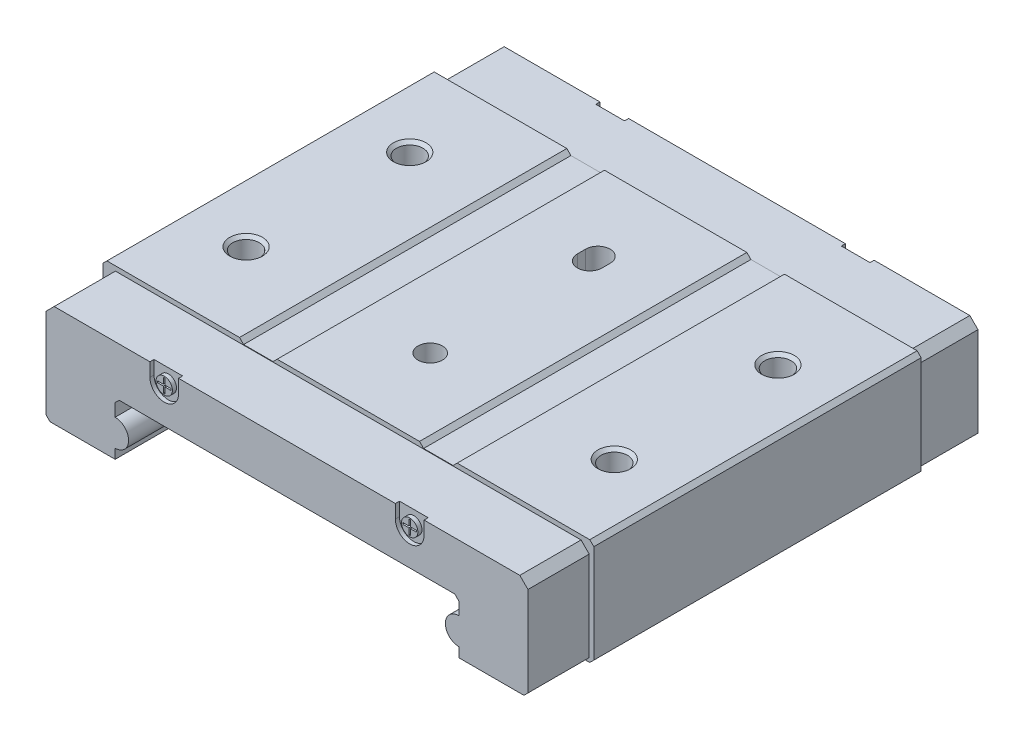
from build123d import *

# Parameters (mm, degrees)
BOSS_EXTRUDE1_DEPTH      = 20
BOSS_EXTRUDE1_DEPTH_BACK = 20
BOSS_EXTRUDE2_DEPTH      = 7.5
BOSS_EXTRUDE2_DEPTH_BACK = 7.5
SKETCH3_W                = 80
SKETCH3_H                = 80
CUT_EXTRUDE1_DEPTH       = 0.02
BOSS_EXTRUDE3_DEPTH      = 7.5
BOSS_EXTRUDE3_DEPTH_BACK = 7.5
CUT_EXTRUDE2_START       = -0.02
SKETCH5_W                = 80
SKETCH5_H                = 80
CUT_EXTRUDE2_DEPTH       = 0.02
CUT_EXTRUDE3_DEPTH       = 0.5
CUT_EXTRUDE3_DEPTH_BACK  = 0.5
CUT_EXTRUDE4_START       = -0.5
CUT_EXTRUDE4_DEPTH       = 0.5
SKETCH8_R                = 1
BOSS_EXTRUDE4_DEPTH      = 0.5
SKETCH9_R                = 1
BOSS_EXTRUDE5_DEPTH      = 0.5
BOSS_EXTRUDE6_START      = -0.5
SKETCH10_R               = 1
BOSS_EXTRUDE6_DEPTH      = 0.5
BOSS_EXTRUDE7_START      = -0.5
SKETCH11_R               = 1
BOSS_EXTRUDE7_DEPTH      = 0.5
SKETCH16_W               = 1.5
SKETCH16_H               = 4
CUT_EXTRUDE5_DEPTH       = 4


with BuildPart() as part:
    # Sketch1 → Boss-Extrude1 (new, two sides: drawn at the far end of the back side and taken through both)
    with BuildSketch(Plane.XY.offset(-BOSS_EXTRUDE1_DEPTH_BACK)):
        with BuildLine():
            Line((-30, 12.505025253), (-30, 0.494974747))
            Line((-30, 0.494974747), (-28.971123718, -0.533901535))
            Line((-28.971123718, -0.533901535), (-21, -0.533901535))
            Line((-21, -0.533901535), (-21, 1.176))
            ThreePointArc((-21, 1.176), (-19.36, 2.816), (-21, 4.456))
            Line((-21, 4.456), (-21, 6.005025253))
            Line((-21, 6.005025253), (-20.505025253, 6.5))
            Line((-20.505025253, 6.5), (20.505025253, 6.5))
            Line((20.505025253, 6.5), (21, 6.005025253))
            Line((21, 6.005025253), (21, 4.456))
            ThreePointArc((21, 4.456), (19.36, 2.816), (21, 1.176))
            Line((21, 1.176), (21, 0))
            Line((21, 0), (29.505025253, 0))
            Line((29.505025253, 0), (30, 0.494974747))
            Line((30, 0.494974747), (30, 12.505025253))
            Line((30, 12.505025253), (29.505025253, 13))
            Line((29.505025253, 13), (13.3, 13))
            Line((13.3, 13), (12.8, 12.5))
            Line((12.8, 12.5), (9.2, 12.5))
            Line((9.2, 12.5), (8.7, 13))
            Line((8.7, 13), (-8.7, 13))
            Line((-8.7, 13), (-9.2, 12.5))
            Line((-9.2, 12.5), (-12.8, 12.5))
            Line((-12.8, 12.5), (-13.3, 13))
            Line((-13.3, 13), (-29.505025253, 13))
            Line((-29.505025253, 13), (-30, 12.505025253))
        make_face()
    extrude(amount=BOSS_EXTRUDE1_DEPTH + BOSS_EXTRUDE1_DEPTH_BACK)

    # Sketch2 → Boss-Extrude2 (add, two sides: drawn at the far end of the back side and taken through both)
    with BuildSketch(Plane.XY.offset(20).offset(-BOSS_EXTRUDE2_DEPTH_BACK)):
        with BuildLine():
            Line((-29.45, 11.452979439), (-29.45, 0.494974747))
            Line((-29.45, 0.494974747), (-28.955025253, 0))
            Line((-28.955025253, 0), (-21, 0))
            Line((-21, 0), (-21, 1.176))
            ThreePointArc((-21, 1.176), (-19.36, 2.816), (-21, 4.456))
            Line((-21, 4.456), (-21, 6.005025253))
            Line((-21, 6.005025253), (-20.505025253, 6.5))
            Line((-20.505025253, 6.5), (20.505025253, 6.5))
            Line((20.505025253, 6.5), (21, 6.005025253))
            Line((21, 6.005025253), (21, 4.456))
            ThreePointArc((21, 4.456), (19.36, 2.816), (21, 1.176))
            Line((21, 1.176), (21, 0))
            Line((21, 0), (28.955025253, 0))
            Line((28.955025253, 0), (29.45, 0.494974747))
            Line((29.45, 0.494974747), (29.45, 11.452979439))
            Line((29.45, 11.452979439), (28.452979439, 12.45))
            Line((28.452979439, 12.45), (-28.452979439, 12.45))
            Line((-28.452979439, 12.45), (-29.45, 11.452979439))
        make_face()
    extrude(amount=BOSS_EXTRUDE2_DEPTH + BOSS_EXTRUDE2_DEPTH_BACK)

    # Sketch3 → Cut-Extrude1 (cut)
    with BuildSketch(Plane.XY.offset(20)):
        Rectangle(SKETCH3_W, SKETCH3_H)
        with BuildLine():
            Line((-29.44, 11.442979439), (-29.44, 0.504974747))
            Line((-29.44, 0.504974747), (-28.945025253, 0.01))
            Line((-28.945025253, 0.01), (-21.01, 0.01))
            Line((-21.01, 0.01), (-21.01, 1.206))
            ThreePointArc((-21.01, 1.206), (-19.39, 2.826), (-21.01, 4.446))
            Line((-21.01, 4.446), (-21.01, 6.51))
            Line((-21.01, 6.51), (21.01, 6.51))
            Line((21.01, 6.51), (21.01, 4.446))
            ThreePointArc((21.01, 4.446), (19.39, 2.826), (21.01, 1.206))
            Line((21.01, 1.206), (21.01, 0.01))
            Line((21.01, 0.01), (28.945025253, 0.01))
            Line((28.945025253, 0.01), (29.44, 0.504974747))
            Line((29.44, 0.504974747), (29.44, 11.442979439))
            Line((29.44, 11.442979439), (28.442979439, 12.44))
            Line((28.442979439, 12.44), (-28.442979439, 12.44))
            Line((-28.442979439, 12.44), (-29.44, 11.442979439))
        make_face(mode=Mode.SUBTRACT)
    extrude(amount=CUT_EXTRUDE1_DEPTH, mode=Mode.SUBTRACT)

    # Sketch4 → Boss-Extrude3 (add, two sides: drawn at the far end of the back side and taken through both)
    with BuildSketch(Plane.XY.offset(-20).offset(-BOSS_EXTRUDE3_DEPTH_BACK)):
        with BuildLine():
            Line((-29.45, 11.452979439), (-29.45, 0.494974747))
            Line((-29.45, 0.494974747), (-28.955025253, 0))
            Line((-28.955025253, 0), (-21, 0))
            Line((-21, 0), (-21, 1.176))
            ThreePointArc((-21, 1.176), (-19.36, 2.816), (-21, 4.456))
            Line((-21, 4.456), (-21, 6.005025253))
            Line((-21, 6.005025253), (-20.505025253, 6.5))
            Line((-20.505025253, 6.5), (20.505025253, 6.5))
            Line((20.505025253, 6.5), (21, 6.005025253))
            Line((21, 6.005025253), (21, 4.456))
            ThreePointArc((21, 4.456), (19.36, 2.816), (21, 1.176))
            Line((21, 1.176), (21, 0))
            Line((21, 0), (28.955025253, 0))
            Line((28.955025253, 0), (29.45, 0.494974747))
            Line((29.45, 0.494974747), (29.45, 11.452979439))
            Line((29.45, 11.452979439), (28.452979439, 12.45))
            Line((28.452979439, 12.45), (-28.452979439, 12.45))
            Line((-28.452979439, 12.45), (-29.45, 11.452979439))
        make_face()
    extrude(amount=BOSS_EXTRUDE3_DEPTH + BOSS_EXTRUDE3_DEPTH_BACK)

    # Sketch5 → Cut-Extrude2 (cut)
    with BuildSketch(Plane.XY.offset(-20).offset(CUT_EXTRUDE2_START)):
        Rectangle(SKETCH5_W, SKETCH5_H)
        with BuildLine():
            Line((-29.44, 11.442979439), (-29.44, 0.504974747))
            Line((-29.44, 0.504974747), (-28.945025253, 0.01))
            Line((-28.945025253, 0.01), (-21.01, 0.01))
            Line((-21.01, 0.01), (-21.01, 1.206))
            ThreePointArc((-21.01, 1.206), (-19.39, 2.826), (-21.01, 4.446))
            Line((-21.01, 4.446), (-21.01, 6.51))
            Line((-21.01, 6.51), (21.01, 6.51))
            Line((21.01, 6.51), (21.01, 4.446))
            ThreePointArc((21.01, 4.446), (19.39, 2.826), (21.01, 1.206))
            Line((21.01, 1.206), (21.01, 0.01))
            Line((21.01, 0.01), (28.945025253, 0.01))
            Line((28.945025253, 0.01), (29.44, 0.504974747))
            Line((29.44, 0.504974747), (29.44, 11.442979439))
            Line((29.44, 11.442979439), (28.442979439, 12.44))
            Line((28.442979439, 12.44), (-28.442979439, 12.44))
            Line((-28.442979439, 12.44), (-29.44, 11.442979439))
        make_face(mode=Mode.SUBTRACT)
    extrude(amount=CUT_EXTRUDE2_DEPTH, mode=Mode.SUBTRACT)

    # Sketch6 → Cut-Extrude3 (cut, two sides: drawn at the far end of the back side and taken through both)
    with BuildSketch(Plane.XY.offset(-27.5).offset(-CUT_EXTRUDE3_DEPTH_BACK)):
        with BuildLine():
            Line((-16.75, 32), (-16.75, 10.8))
            ThreePointArc((-16.75, 10.8), (-15, 9.05), (-13.25, 10.8))
            Line((-13.25, 10.8), (-13.25, 30.82500207))
            Line((-13.25, 30.82500207), (13.25, 30.82500207))
            Line((13.25, 30.82500207), (13.25, 10.8))
            ThreePointArc((13.25, 10.8), (15, 9.05), (16.75, 10.8))
            Line((16.75, 10.8), (16.75, 32))
            Line((16.75, 32), (-16.75, 32))
        make_face()
    extrude(amount=CUT_EXTRUDE3_DEPTH + CUT_EXTRUDE3_DEPTH_BACK, mode=Mode.SUBTRACT)

    # Sketch7 → Cut-Extrude4 (cut)
    with BuildSketch(Plane.XY.offset(27.5).offset(CUT_EXTRUDE4_START)):
        with BuildLine():
            Line((-16.75, 32), (-16.75, 10.8))
            ThreePointArc((-16.75, 10.8), (-15, 9.05), (-13.25, 10.8))
            Line((-13.25, 10.8), (-13.25, 30.82500207))
            Line((-13.25, 30.82500207), (13.25, 30.82500207))
            Line((13.25, 30.82500207), (13.25, 10.8))
            ThreePointArc((13.25, 10.8), (15, 9.05), (16.75, 10.8))
            Line((16.75, 10.8), (16.75, 32))
            Line((16.75, 32), (-16.75, 32))
        make_face()
    extrude(amount=CUT_EXTRUDE4_DEPTH, mode=Mode.SUBTRACT)

    # Sketch8 → Boss-Extrude4 (add)
    with BuildSketch(Plane.XY.offset(-27.5)):
        with Locations((-15, 10.8)):
            Circle(SKETCH8_R)
        Polygon((-15.85, 10.9), (-15.85, 10.7), (-15.1, 10.7), (-15.1, 9.95), (-14.9, 9.95), (-14.9, 10.7), (-14.15, 10.7), (-14.15, 10.9), (-14.9, 10.9), (-14.9, 11.65), (-15.1, 11.65), (-15.1, 10.9), align=None, mode=Mode.SUBTRACT)
    extrude(amount=BOSS_EXTRUDE4_DEPTH)

    # Sketch9 → Boss-Extrude5 (add)
    with BuildSketch(Plane.XY.offset(-27.5)):
        with Locations((15, 10.8)):
            Circle(SKETCH9_R)
        Polygon((14.15, 10.9), (14.15, 10.7), (14.9, 10.7), (14.9, 9.95), (15.1, 9.95), (15.1, 10.7), (15.85, 10.7), (15.85, 10.9), (15.1, 10.9), (15.1, 11.65), (14.9, 11.65), (14.9, 10.9), align=None, mode=Mode.SUBTRACT)
    extrude(amount=BOSS_EXTRUDE5_DEPTH)

    # Sketch10 → Boss-Extrude6 (add)
    with BuildSketch(Plane.XY.offset(27.5).offset(BOSS_EXTRUDE6_START)):
        with Locations((-15, 10.8)):
            Circle(SKETCH10_R)
        Polygon((-15.85, 10.9), (-15.85, 10.7), (-15.1, 10.7), (-15.1, 9.95), (-14.9, 9.95), (-14.9, 10.7), (-14.15, 10.7), (-14.15, 10.9), (-14.9, 10.9), (-14.9, 11.65), (-15.1, 11.65), (-15.1, 10.9), align=None, mode=Mode.SUBTRACT)
    extrude(amount=BOSS_EXTRUDE6_DEPTH)

    # Sketch11 → Boss-Extrude7 (add)
    with BuildSketch(Plane.XY.offset(27.5).offset(BOSS_EXTRUDE7_START)):
        with Locations((15, 10.8)):
            Circle(SKETCH11_R)
        Polygon((14.15, 10.9), (14.15, 10.7), (14.9, 10.7), (14.9, 9.95), (15.1, 9.95), (15.1, 10.7), (15.85, 10.7), (15.85, 10.9), (15.1, 10.9), (15.1, 11.65), (14.9, 11.65), (14.9, 10.9), align=None, mode=Mode.SUBTRACT)
    extrude(amount=BOSS_EXTRUDE7_DEPTH)

    # Sketch12 → Cut-Revolve1 (revolve, cut)
    with BuildSketch(Plane(origin=(22.5, 0, 0), x_dir=(0, 0, -1), z_dir=(1, 0, 0))):
        Polygon((-10, 13), (-8, 13), (-8.379, 12.621), (-8.379, 7.185884786), (-10, 6.25), align=None)
    revolve(axis=Axis((22.5, 6.25, 10), (0, 1, 0)), mode=Mode.SUBTRACT)

    # Sketch13 → Cut-Revolve2 (revolve, cut)
    with BuildSketch(Plane(origin=(-22.5, 0, 0), x_dir=(0, 0, -1), z_dir=(1, 0, 0))):
        Polygon((10, 13), (12, 13), (11.621, 12.621), (11.621, 7.185884786), (10, 6.25), align=None)
    revolve(axis=Axis((-22.5, 6.25, -10), (0, 1, 0)), mode=Mode.SUBTRACT)

    # Sketch14 → Cut-Revolve3 (revolve, cut)
    with BuildSketch(Plane(origin=(22.5, 0, 0), x_dir=(0, 0, -1), z_dir=(1, 0, 0))):
        Polygon((10, 13), (12, 13), (11.621, 12.621), (11.621, 7.185884786), (10, 6.25), align=None)
    revolve(axis=Axis((22.5, 6.25, -10), (0, 1, 0)), mode=Mode.SUBTRACT)

    # Sketch15 → Cut-Revolve4 (revolve, cut)
    with BuildSketch(Plane(origin=(-22.5, 0, 0), x_dir=(0, 0, -1), z_dir=(1, 0, 0))):
        Polygon((-10, 13), (-8, 13), (-8.379, 12.621), (-8.379, 7.185884786), (-10, 6.25), align=None)
    revolve(axis=Axis((-22.5, 6.25, 10), (0, 1, 0)), mode=Mode.SUBTRACT)

    # Sketch16 → Cut-Revolve5 (revolve, cut)
    with BuildSketch(Plane.XY.offset(10)):
        with Locations((0.75, 11)):
            Rectangle(SKETCH16_W, SKETCH16_H)
    revolve(axis=Axis((0, 9, 10), (0, 1, 0)), mode=Mode.SUBTRACT)

    # Sketch17 → Cut-Extrude5 (cut)
    with BuildSketch(Plane(origin=(0, 13, 0), x_dir=(-1, 0, 0), z_dir=(0, 1, 0))):
        with BuildLine():
            Line((1.5, -10.5), (1.5, -9.5))
            ThreePointArc((1.5, -9.5), (0, -8), (-1.5, -9.5))
            Line((-1.5, -9.5), (-1.5, -10.5))
            ThreePointArc((-1.5, -10.5), (0, -12), (1.5, -10.5))
        make_face()
    extrude(amount=-CUT_EXTRUDE5_DEPTH, mode=Mode.SUBTRACT)


solid = part.part
